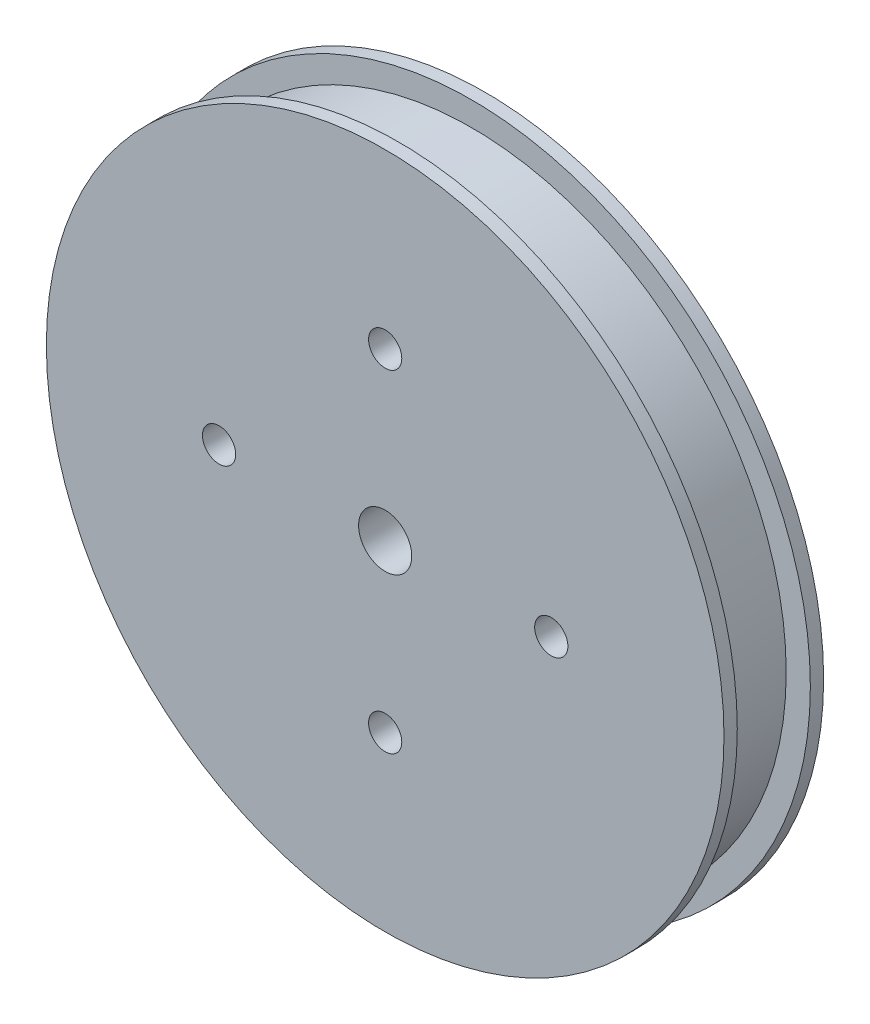
from build123d import *

# Parameters (mm, degrees)
SKETCH_1_R            = 51
SKETCH_1_R_2          = 4
EXTRUDE_1_DEPTH       = 15
HOLE_WIZARD_5_0_5_1_D = 5
CUT_EXTRUDE_START     = -13
SKETCH_4_R            = 51
SKETCH_4_R_2          = 47.365
CUT_EXTRUDE_2_DEPTH   = 11


with BuildPart() as part:
    # 草图1 → 凸台-拉伸1 (new body)
    with BuildSketch(Plane.XY):
        Circle(SKETCH_1_R)
        Circle(SKETCH_1_R_2, mode=Mode.SUBTRACT)
    extrude(amount=EXTRUDE_1_DEPTH)

    # Ø5.0 (5) 直径孔1 (through all)
    with Locations(Plane.XY.offset(15)):
        with Locations((25, 0), (0, 25), (-25, 0), (0, -25)):
            Hole(HOLE_WIZARD_5_0_5_1_D / 2)

    # 草图4 → 切除-拉伸2 (cut)
    with BuildSketch(Plane.XY.offset(15).offset(CUT_EXTRUDE_START)):
        Circle(SKETCH_4_R)
        Circle(SKETCH_4_R_2, mode=Mode.SUBTRACT)
    extrude(amount=CUT_EXTRUDE_2_DEPTH, mode=Mode.SUBTRACT)


solid = part.part
